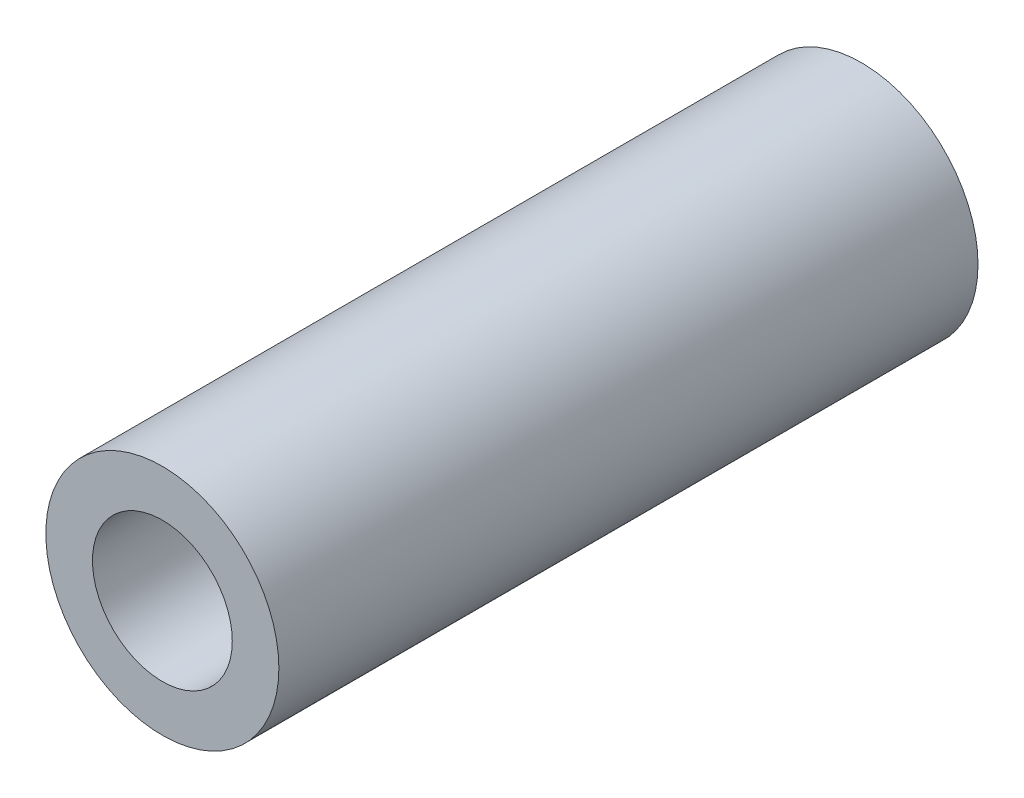
from build123d import *

# Parameters (mm, degrees)
SKETCH_1_R      = 2.5
SKETCH_1_R_2    = 1.5
EXTRUDE_1_DEPTH = 7.5


with BuildPart() as part:
    # 草图1 → 凸台-拉伸1 (new, symmetric)
    with BuildSketch(Plane.XY):
        Circle(SKETCH_1_R)
        Circle(SKETCH_1_R_2, mode=Mode.SUBTRACT)
    extrude(amount=EXTRUDE_1_DEPTH, both=True)


solid = part.part
